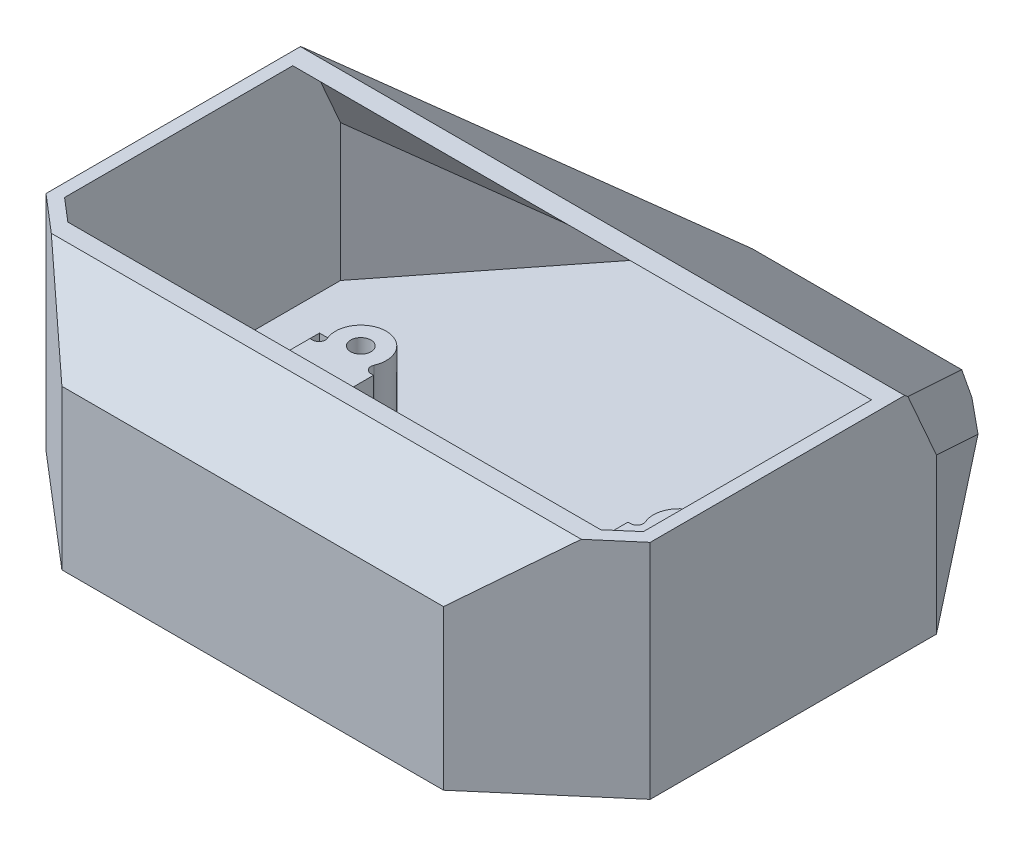
from build123d import *

# Parameters (mm, degrees)
AUFSATZ_LINEAR_AUSTRAGEN1_DEPTH      = 35
SCHNITT_LINEAR_AUSTRAGEN1_DEPTH      = 85.150163399
SCHNITT_LINEAR_AUSTRAGEN1_DEPTH_BACK = 85.150163399
FASE6_SIZE                           = 3
FASE6_SIZE2                          = 5.591073264
FASE6_EDGE_2_SIZE                    = 3
FASE6_EDGE_2_SIZE2                   = 5.591073264
FASE7_SIZE                           = 10
WANDUNG3_T                           = -2
SCHNITT_LINEAR_AUSTRAGEN2_REACH      = 86.15
SKIZZE9_W                            = 10
SKIZZE9_H                            = 35
SKIZZE10_R                           = 1.6
AUFSATZ_LINEAR_AUSTRAGEN3_DEPTH      = 10
VERRUNDUNG4_R                        = 1


with BuildPart() as part:
    # Skizze6 → Aufsatz-Linear austragen1 (new body)
    with BuildSketch(Plane(origin=(0, 0, 0), x_dir=(1, 0, 0), z_dir=(0, 1, 0))):
        Polygon((30, -35), (-30, -35), (-47.5, -20), (-47.5, 25), (-20, 60), (20, 60), (47.5, 25), (47.5, -20), align=None)
    extrude(amount=AUFSATZ_LINEAR_AUSTRAGEN1_DEPTH)

    # Skizze8 → Schnitt-Linear austragen1 (cut, two sides: drawn at the far end of the back side and taken through both)
    with BuildSketch(Plane(origin=(0, 0, 0), x_dir=(0, 0, -1), z_dir=(1, 0, 0)).offset(-SCHNITT_LINEAR_AUSTRAGEN1_DEPTH_BACK)):
        Polygon((20, 35), (60, 3), (60, 35), align=None)
    extrude(amount=SCHNITT_LINEAR_AUSTRAGEN1_DEPTH + SCHNITT_LINEAR_AUSTRAGEN1_DEPTH_BACK, mode=Mode.SUBTRACT)

    # Fase6
    fase6_edges = [part.edges().sort_by_distance(p)[0] for p in [
        (33.75, 17, -42.5),
    ]]
    fase6_side = [part.faces().sort_by_distance(p)[0] for p in [
        (0, 21.261380323, -37.173274596),
    ]]
    chamfer(fase6_edges, length=FASE6_SIZE, length2=FASE6_SIZE2, reference=fase6_side[0])

    # Fase6 edge 2
    fase6_edge_2_edges = [part.edges().sort_by_distance(p)[0] for p in [
        (-33.75, 17, -42.5),
    ]]
    fase6_edge_2_side = [part.faces().sort_by_distance(p)[0] for p in [
        (0, 21.261380323, -37.173274596),
    ]]
    chamfer(fase6_edge_2_edges, length=FASE6_EDGE_2_SIZE, length2=FASE6_EDGE_2_SIZE2, reference=fase6_edge_2_side[0])

    # Fase7
    fase7_edges = [part.edges().sort_by_distance(p)[0] for p in [
        (0, 35, 35),
    ]]
    chamfer(fase7_edges, length=FASE7_SIZE)

    # Wandung3
    wandung3_openings = [part.faces().sort_by_distance(p)[0] for p in [
        (0, 35, 2.356885836),
    ]]
    offset(amount=WANDUNG3_T, openings=wandung3_openings, kind=Kind.INTERSECTION)

    # Skizze9 → Schnitt-Linear austragen2 (cut, up to next)
    with BuildSketch(Plane.XZ, mode=Mode.PRIVATE) as schnitt_linear_austragen2_sk1:
        with Locations((-35, 2)):
            Rectangle(SKIZZE9_W, SKIZZE9_H)
    schnitt_linear_austragen2_tool1 = extrude(schnitt_linear_austragen2_sk1.sketch, amount=-SCHNITT_LINEAR_AUSTRAGEN2_REACH, mode=Mode.PRIVATE) & part.part
    # Skizze9 → Schnitt-Linear austragen2 (cut, up to next)
    with BuildSketch(Plane.XZ, mode=Mode.PRIVATE) as schnitt_linear_austragen2_sk2:
        with Locations((35, 2)):
            Rectangle(SKIZZE9_W, SKIZZE9_H)
    schnitt_linear_austragen2_tool2 = extrude(schnitt_linear_austragen2_sk2.sketch, amount=-SCHNITT_LINEAR_AUSTRAGEN2_REACH, mode=Mode.PRIVATE) & part.part
    add(schnitt_linear_austragen2_tool1.solids().sort_by_distance((-35, 0, 2))[0], mode=Mode.SUBTRACT)
    add(schnitt_linear_austragen2_tool2.solids().sort_by_distance((35, 0, 2))[0], mode=Mode.SUBTRACT)

    # Skizze10 → Aufsatz-Linear austragen3 (add)
    # profile 1 of 2: a face of its own
    with BuildSketch(Plane(origin=(0, 2, 0), x_dir=(1, 0, 0), z_dir=(0, 1, 0))):
        with BuildLine():
            Line((-30, 4), (-27.645751311, 4))
            ThreePointArc((-27.645751311, 4), (-25, 11), (-22.354248689, 4))
            Line((-22.354248689, 4), (-20, 4))
            Line((-20, 4), (-20, -8))
            Line((-20, -8), (-22.354248689, -8))
            ThreePointArc((-22.354248689, -8), (-25, -15), (-27.645751311, -8))
            Line((-27.645751311, -8), (-30, -8))
            Line((-30, -8), (-30, 4))
        make_face()
        with Locations(Location((-25, 7, 0), (0, 0, 270))):
            Circle(SKIZZE10_R, mode=Mode.SUBTRACT)
        with Locations(Location((-25, -11, 0), (0, 0, 90))):
            Circle(SKIZZE10_R, mode=Mode.SUBTRACT)
    # profile 2 of 2: a face of its own
    with BuildSketch(Plane(origin=(0, 2, 0), x_dir=(1, 0, 0), z_dir=(0, 1, 0))):
        with BuildLine():
            Line((22.354248689, -8), (20, -8))
            Line((20, -8), (20, 4))
            Line((20, 4), (22.354248689, 4))
            ThreePointArc((22.354248689, 4), (25, 11), (27.645751311, 4))
            Line((27.645751311, 4), (30, 4))
            Line((30, 4), (30, -8))
            Line((30, -8), (27.645751311, -8))
            ThreePointArc((27.645751311, -8), (25, -15), (22.354248689, -8))
        make_face()
        with Locations(Location((25, -11, 0), (0, 0, 270))):
            Circle(SKIZZE10_R, mode=Mode.SUBTRACT)
        with Locations(Location((25, 7, 0), (0, 0, 90))):
            Circle(SKIZZE10_R, mode=Mode.SUBTRACT)
    extrude(amount=AUFSATZ_LINEAR_AUSTRAGEN3_DEPTH)

    # Verrundung4
    verrundung4_edges = [part.edges().sort_by_distance(p)[0] for p in [
        (-22.354248689, 7, 8),
        (-22.354248689, 7, -4),
        (-27.645751311, 7, -4),
        (-27.645751311, 7, 8),
        (27.645751311, 7, -4),
        (22.354248689, 7, -4),
        (22.354248689, 7, 8),
        (27.645751311, 7, 8),
    ]]
    fillet(verrundung4_edges, radius=VERRUNDUNG4_R)


solid = part.part
